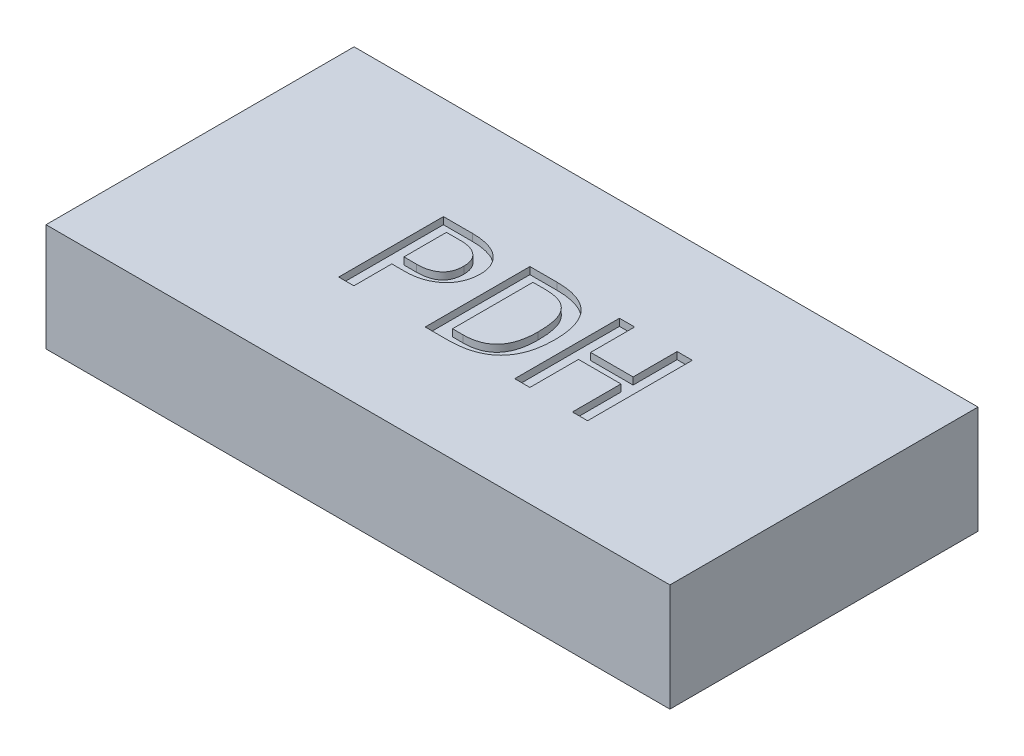
from build123d import *

# Parameters (mm, degrees)
SKETCH1_W           = 224.79
SKETCH1_H           = 110.998
BOSS_EXTRUDE1_DEPTH = 19.38655
CUT_EXTRUDE1_DEPTH  = 2.54


with BuildPart() as part:
    # Sketch1 → Boss-Extrude1 (new, symmetric)
    with BuildSketch(Plane(origin=(0, 0, 0), x_dir=(1, 0, 0), z_dir=(0, 1, 0))):
        with Locations((112.395, 55.499)):
            Rectangle(SKETCH1_W, SKETCH1_H)
    extrude(amount=BOSS_EXTRUDE1_DEPTH, both=True)

    # Sketch2 → Cut-Extrude1 (cut)
    # profile 1 of 3: a face of its own
    with BuildSketch(Plane(origin=(0, 19.38655, 0), x_dir=(1, 0, 0), z_dir=(0, 1, 0))):
        with BuildLine():
            add(Edge.make_bspline(
                [(93.6654446, 62.638119725), (93.65621175, 62.255926888), (93.637663033, 61.488104777), (93.466421809, 60.341834085), (93.201255703, 59.201705874), (92.836997723, 58.075217304), (92.359286935, 56.979010165), (91.762331794, 55.932624231), (91.032595392, 54.955716054), (90.207106522, 54.027487516), (89.252652089, 53.179116743), (88.173798237, 52.414727304), (86.973600637, 51.734204765), (85.655660468, 51.128628725), (84.202701193, 50.653409294), (82.618753702, 50.300761726), (80.898189452, 50.099121533), (79.705954978, 50.07473573), (79.09029785, 50.062143162)],
                knots=[0, 0, 0, 0, 0.84837333, 1.704374698, 2.568122001, 3.446177459, 4.329841521, 5.219461111, 6.115085959, 7.03322926, 7.973947317, 8.94447037, 9.964314875, 11.034235969, 12.160282575, 13.352588404, 14.632904974, 16, 16, 16, 16], degree=3))
            Line((79.09029785, 50.062143162), (74.528088962, 50.062143162))
            Line((74.528088962, 50.062143162), (74.528088962, 36.39260342))
            Line((74.528088962, 36.39260342), (69.060273065, 36.39260342))
            Line((69.060273065, 36.39260342), (69.060273065, 74.120533108))
            Line((69.060273065, 74.120533108), (79.611449053, 74.120533108))
            add(Edge.make_bspline(
                [(79.611449053, 74.120533108), (80.070260309, 74.115673927), (80.980958213, 74.106028903), (82.329353652, 73.976911734), (83.651671763, 73.795021467), (84.937147693, 73.523102459), (86.171480276, 73.166358976), (87.344146306, 72.730911072), (88.422755699, 72.162952721), (89.43560104, 71.526521333), (90.368402205, 70.791840353), (91.189022047, 69.939252772), (91.912770344, 68.989458848), (92.539599198, 67.944691466), (93.055694596, 66.787250357), (93.402550005, 65.504823346), (93.635402669, 64.110350409), (93.655195832, 63.140369447), (93.6654446, 62.638119725)],
                knots=[0, 0, 0, 0, 1.071095419, 2.126025337, 3.160633674, 4.187194637, 5.191188192, 6.159546808, 7.102471747, 8.032359578, 8.950543616, 9.867691343, 10.788184798, 11.733733012, 12.707489344, 13.737062018, 14.82826569, 16, 16, 16, 16], degree=3))
        make_face()
        with BuildLine():
            add(Edge.make_bspline(
                [(88.197628703, 62.347642005), (88.192174404, 62.63850916), (88.18154377, 63.205420092), (88.067270065, 64.026417972), (87.887321266, 64.795998376), (87.642204989, 65.513494356), (87.324445545, 66.181041679), (86.9271256, 66.789508742), (86.462833318, 67.351595169), (85.92370252, 67.854044286), (85.320326107, 68.296325862), (84.670815804, 68.696121206), (83.954231053, 69.019190265), (83.180431142, 69.281086893), (82.353689397, 69.498799431), (81.465989989, 69.635809834), (80.527957319, 69.737538529), (79.882297045, 69.743319744), (79.551644817, 69.74628039)],
                knots=[0, 0, 0, 0, 1.07893025, 2.102875295, 3.069403633, 4.00867391, 4.911619206, 5.805799344, 6.69897942, 7.61127936, 8.532960211, 9.47193309, 10.436783978, 11.442898866, 12.50165651, 13.605056338, 14.773513735, 16, 16, 16, 16], degree=3))
            Line((79.551644817, 69.74628039), (74.528088962, 69.74628039))
            Line((74.528088962, 69.74628039), (74.528088962, 54.43639588))
            Line((74.528088962, 54.43639588), (79.115928237, 54.43639588))
            add(Edge.make_bspline(
                [(79.115928237, 54.43639588), (79.469215163, 54.444058583), (80.154049634, 54.458912469), (81.153694325, 54.542163566), (82.091850755, 54.691905292), (82.964265919, 54.917155421), (83.774695488, 55.18910777), (84.524586407, 55.521306188), (85.210072438, 55.925895812), (85.836535364, 56.387055958), (86.399655255, 56.909209561), (86.877940326, 57.506401351), (87.291847487, 58.157818385), (87.628287432, 58.875259995), (87.880108968, 59.657394144), (88.069138486, 60.497611643), (88.18153711, 61.401962584), (88.192147378, 62.025512532), (88.197628703, 62.347642005)],
                knots=[0, 0, 0, 0, 1.232805628, 2.389751021, 3.4973379, 4.54330244, 5.530003372, 6.477393866, 7.399377973, 8.301660217, 9.187431021, 10.070466494, 10.963674817, 11.874940633, 12.827061481, 13.825105319, 14.876436953, 16, 16, 16, 16], degree=3))
        make_face(mode=Mode.SUBTRACT)
    # profile 2 of 3: a face of its own
    with BuildSketch(Plane(origin=(0, 19.38655, 0), x_dir=(1, 0, 0), z_dir=(0, 1, 0))):
        with BuildLine():
            add(Edge.make_bspline(
                [(127.56590316, 55.675197919), (127.547617612, 54.78857119), (127.511689457, 53.046492477), (127.23969054, 50.905769989), (126.922569652, 49.262016243), (126.614411717, 48.087206761), (126.246431872, 46.950715858), (125.811824352, 45.860819894), (125.314265868, 44.812615172), (124.753130965, 43.8086857), (124.107420568, 42.863739226), (123.409082848, 41.959258432), (122.626828334, 41.117422828), (121.7596775, 40.338177311), (120.809466051, 39.618619159), (119.771337822, 38.967548349), (118.647283346, 38.391422091), (117.447711896, 37.861858683), (116.153140186, 37.424384305), (114.773384937, 37.046415803), (113.301688648, 36.744518404), (111.730514486, 36.548407326), (110.065508535, 36.414654635), (108.921503761, 36.400080642), (108.334569436, 36.39260342)],
                knots=[0, 0, 0, 0, 1.874627119, 3.68334034, 4.55511198, 5.414139205, 6.25033141, 7.080252411, 7.893905149, 8.703019486, 9.509911256, 10.312362027, 11.117881282, 11.936734267, 12.775179546, 13.635831221, 14.524848569, 15.444673208, 16.406604644, 17.411911457, 18.469143348, 19.580838344, 20.758843452, 22, 22, 22, 22], degree=3))
            Line((108.334569436, 36.39260342), (100.226823676, 36.39260342))
            Line((100.226823676, 36.39260342), (100.226823676, 74.120533108))
            Line((100.226823676, 74.120533108), (109.983457667, 74.120533108))
            add(Edge.make_bspline(
                [(109.983457667, 74.120533108), (110.698796565, 74.108775888), (112.087312401, 74.085954417), (114.099407103, 73.871359676), (115.971010991, 73.513186255), (117.705932553, 73.024742171), (119.296694788, 72.37897733), (120.753078111, 71.603929555), (122.063935524, 70.672214529), (123.234870408, 69.595919293), (124.268375898, 68.375042443), (125.15212849, 66.998343044), (125.905974417, 65.477332321), (126.520334079, 63.804439371), (126.984079723, 61.979297568), (127.323005556, 60.011417912), (127.529971236, 57.892365797), (127.553664927, 56.430354144), (127.56590316, 55.675197919)],
                knots=[0, 0, 0, 0, 1.17177347, 2.274482801, 3.310388109, 4.291013938, 5.222472681, 6.118087065, 6.988127256, 7.850034114, 8.717518086, 9.601485366, 10.523818561, 11.493740021, 12.515690363, 13.604990885, 14.762933224, 16, 16, 16, 16], degree=3))
        make_face()
        with BuildLine():
            add(Edge.make_bspline(
                [(122.098087263, 55.239481339), (122.091167759, 55.883338842), (122.07786261, 57.121378364), (121.941863816, 58.899207539), (121.714490077, 60.523833747), (121.395141619, 62.00003254), (120.973701982, 63.330931753), (120.478179626, 64.534888844), (119.856705316, 65.588603714), (119.150728012, 66.521049001), (118.340699821, 67.317635038), (117.439068976, 68.005524695), (116.438452675, 68.568612468), (115.337592989, 69.003716428), (114.147410598, 69.331977904), (112.863376849, 69.585308184), (111.475458259, 69.713259964), (110.519060263, 69.735050507), (110.026174979, 69.74628039)],
                knots=[0, 0, 0, 0, 1.413547595, 2.71803587, 3.911871408, 5.013341294, 6.029850817, 6.974090411, 7.865305992, 8.708270035, 9.535123508, 10.351794371, 11.191784495, 12.047569406, 12.944296091, 13.8996306, 14.91756238, 16, 16, 16, 16], degree=3))
            Line((110.026174979, 69.74628039), (105.694639573, 69.74628039))
            Line((105.694639573, 69.74628039), (105.694639573, 40.766856138))
            Line((105.694639573, 40.766856138), (109.462306464, 40.766856138))
            add(Edge.make_bspline(
                [(109.462306464, 40.766856138), (109.972390662, 40.779628967), (110.963897054, 40.804456912), (112.404673192, 40.959074575), (113.741396992, 41.254449715), (114.982492322, 41.645412228), (116.128283102, 42.146846942), (117.168651881, 42.778873861), (118.119824521, 43.514260641), (118.95603885, 44.379608434), (119.710984868, 45.341779056), (120.348177326, 46.429272224), (120.897700383, 47.621563924), (121.340339899, 48.927882581), (121.678563879, 50.347150333), (121.924720399, 51.877582623), (122.068484344, 53.522343822), (122.088017719, 54.655390557), (122.098087263, 55.239481339)],
                knots=[0, 0, 0, 0, 1.112402768, 2.162298815, 3.153767855, 4.092494856, 4.996014567, 5.873553179, 6.740614794, 7.610074679, 8.4907496, 9.401305331, 10.351566166, 11.349161427, 12.403455731, 13.529502205, 14.72644707, 16, 16, 16, 16], degree=3))
        make_face(mode=Mode.SUBTRACT)
    # profile 3 of 3: a face of its own
    with BuildSketch(Plane(origin=(0, 19.38655, 0), x_dir=(1, 0, 0), z_dir=(0, 1, 0))):
        Polygon((158.732453771, 36.39260342), (153.264637875, 36.39260342), (153.264637875, 53.88961429), (137.954753364, 53.88961429), (137.954753364, 36.39260342), (132.486937467, 36.39260342), (132.486937467, 74.120533108), (137.954753364, 74.120533108), (137.954753364, 58.263867007), (153.264637875, 58.263867007), (153.264637875, 74.120533108), (158.732453771, 74.120533108), align=None)
    extrude(amount=-CUT_EXTRUDE1_DEPTH, mode=Mode.SUBTRACT)


solid = part.part
